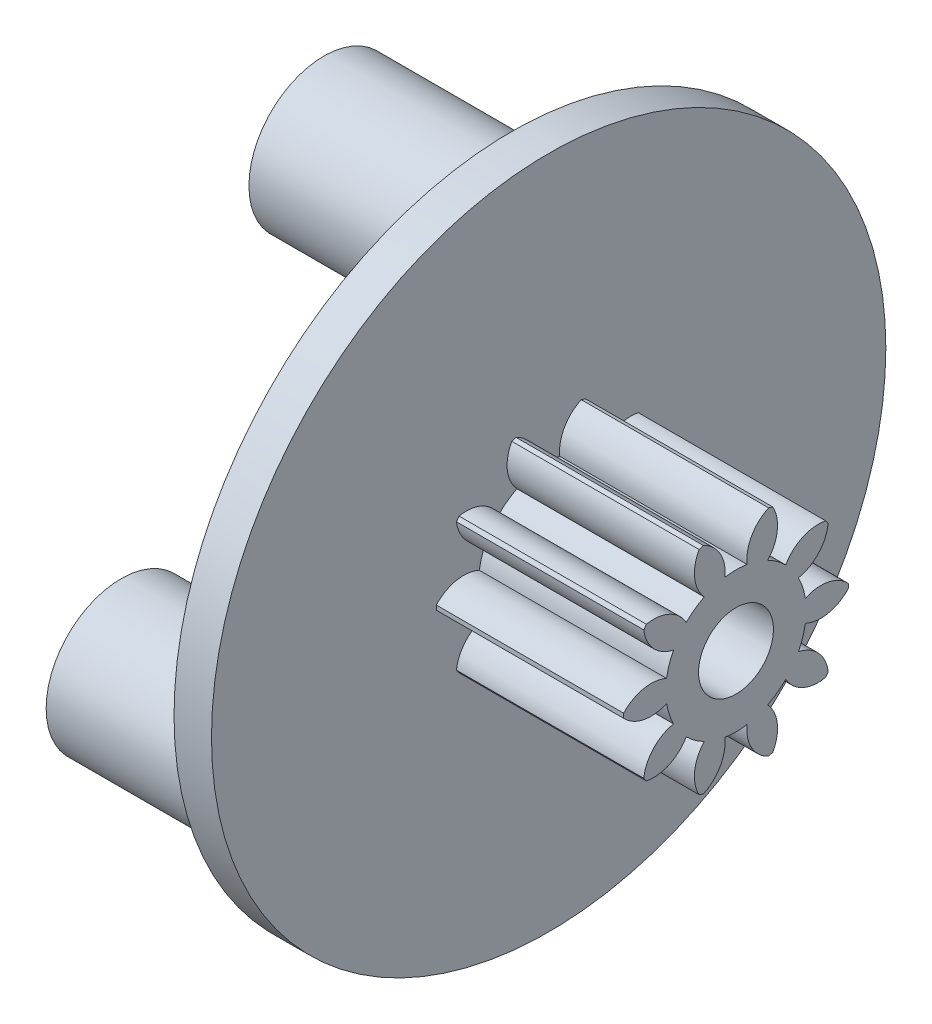
from build123d import *

# Parameters (mm, degrees)
BASPROSKE_W     = 5
BASPROSKE_H     = 3
TOOTHCUT_DEPTH  = 7.557438524
TEETHCUTS_COUNT = 10
TEETHCUTS_ANGLE = 324
BORSKE_R        = 1
BORE_DEPTH      = 50.000762
SKETCH_1_R      = 9
SKETCH_1_R_2    = 1.5
EXTRUDE_1_DEPTH = 1
EXTRUDE_START   = 1
SKETCH_1_3_R    = 2
EXTRUDE_2_DEPTH = 5


with BuildPart() as part:
    # BasProSke → Base-Revolve (revolve)
    with BuildSketch(Plane(origin=(0, 0, 0), x_dir=(1, 0, 0), z_dir=(0, 1, 0)), mode=Mode.PRIVATE) as base_revolve_sk:
        with Locations((2.5, 1.5)):
            Rectangle(BASPROSKE_W, BASPROSKE_H)
    revolve(base_revolve_sk.sketch.rotate(Axis((-10, 0, 0), (1, 0, 0)), 180), axis=Axis((-10, 0, 0), (1, 0, 0)))

    # TooCutSke → ToothCut (cut, through all)
    with BuildSketch(Plane(origin=(0, 0, 0), x_dir=(0, 0, -1), z_dir=(1, 0, 0))):
        with BuildLine():
            ThreePointArc((0.296449938, 1.850403587), (0, 1.874), (-0.296449938, 1.850403587))
            ThreePointArc((-0.296449938, 1.850403587), (-0.428089565, 2.470295585), (-0.905889751, 2.886591228))
            ThreePointArc((-0.905889751, 2.886591228), (0, 3.0254), (0.905889751, 2.886591228))
            ThreePointArc((0.905889751, 2.886591228), (0.428089565, 2.470295585), (0.296449938, 1.850403587))
        make_face()
    toothcut = extrude(amount=TOOTHCUT_DEPTH, mode=Mode.SUBTRACT)

    # TeethCuts: ToothCut ×10 about axis
    teethcuts_axis = Axis((-10, 0, 0), (1, 0, 0))
    for i in range(1, TEETHCUTS_COUNT):
        add(toothcut.rotate(teethcuts_axis, i * TEETHCUTS_ANGLE / (TEETHCUTS_COUNT - 1)), mode=Mode.SUBTRACT)

    # BorSke → Bore (cut, symmetric)
    with BuildSketch(Plane(origin=(0, 0, 0), x_dir=(0, 0, -1), z_dir=(1, 0, 0))):
        with Locations(Location((0, 0, 0), (0, 0, 180))):
            Circle(BORSKE_R)
    extrude(amount=BORE_DEPTH, both=True, mode=Mode.SUBTRACT)

    # 草图1 → 凸台-拉伸1 (add)
    with BuildSketch(Plane.ZY):
        Circle(SKETCH_1_R)
        Circle(SKETCH_1_R_2, mode=Mode.SUBTRACT)
    extrude(amount=EXTRUDE_1_DEPTH)

    # 草图1<3> → 凸台-拉伸2 (add)
    with BuildSketch(Plane.ZY.offset(EXTRUDE_START)):
        with Locations((0, 6.25)):
            Circle(SKETCH_1_3_R)
        with Locations((-5.412658774, -3.125)):
            Circle(SKETCH_1_3_R)
        with Locations((5.412658774, -3.125)):
            Circle(SKETCH_1_3_R)
    extrude(amount=EXTRUDE_2_DEPTH)


solid = part.part
